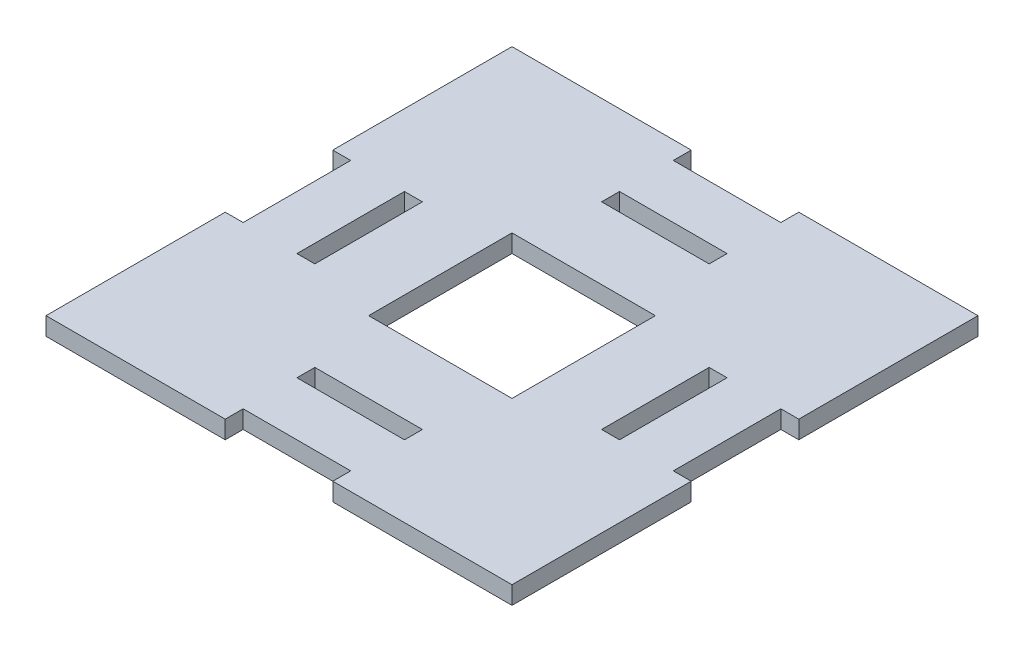
from build123d import *

# Parameters (mm, degrees)
SKETCH1_W           = 82.55
SKETCH1_H           = 82.55
BOSS_EXTRUDE1_DEPTH = 3.175
SKETCH2_W           = 25.4
SKETCH2_H           = 25.4
SKETCH2_W_2         = 19.05
SKETCH2_H_2         = 3.175
SKETCH2_W_3         = 3.175
SKETCH2_H_3         = 19.05
CUT_EXTRUDE1_DEPTH  = 3.175
SKETCH3_W           = 19.05
SKETCH3_H           = 3.175
SKETCH3_W_2         = 3.175
SKETCH3_H_2         = 19.05
CUT_EXTRUDE2_DEPTH  = 3.175


with BuildPart() as part:
    # Sketch1 → Boss-Extrude1 (new body)
    with BuildSketch(Plane(origin=(0, 0, 0), x_dir=(1, 0, 0), z_dir=(0, 1, 0))):
        with Locations((41.275, 41.275)):
            Rectangle(SKETCH1_W, SKETCH1_H)
    extrude(amount=BOSS_EXTRUDE1_DEPTH)

    # Sketch2 → Cut-Extrude1 (cut)
    with BuildSketch(Plane(origin=(0, 3.175, 0), x_dir=(1, 0, 0), z_dir=(0, 1, 0))):
        with Locations((41.275, 41.275)):
            Rectangle(SKETCH2_W, SKETCH2_H)
        with Locations((41.275, 68.2625)):
            Rectangle(SKETCH2_W_2, SKETCH2_H_2)
        with Locations((14.2875, 41.275)):
            Rectangle(SKETCH2_W_3, SKETCH2_H_3)
        with Locations((68.2625, 41.275)):
            Rectangle(SKETCH2_W_3, SKETCH2_H_3)
        with Locations((41.275, 14.2875)):
            Rectangle(SKETCH2_W_2, SKETCH2_H_2)
    extrude(amount=-CUT_EXTRUDE1_DEPTH, mode=Mode.SUBTRACT)

    # Sketch3 → Cut-Extrude2 (cut)
    with BuildSketch(Plane(origin=(0, 3.175, 0), x_dir=(1, 0, 0), z_dir=(0, 1, 0))):
        with Locations((41.275, 80.9625)):
            Rectangle(SKETCH3_W, SKETCH3_H)
        with Locations((80.9625, 41.275)):
            Rectangle(SKETCH3_W_2, SKETCH3_H_2)
        with Locations((41.275, 1.5875)):
            Rectangle(SKETCH3_W, SKETCH3_H)
        with Locations((1.5875, 41.275)):
            Rectangle(SKETCH3_W_2, SKETCH3_H_2)
    extrude(amount=-CUT_EXTRUDE2_DEPTH, mode=Mode.SUBTRACT)


solid = part.part
